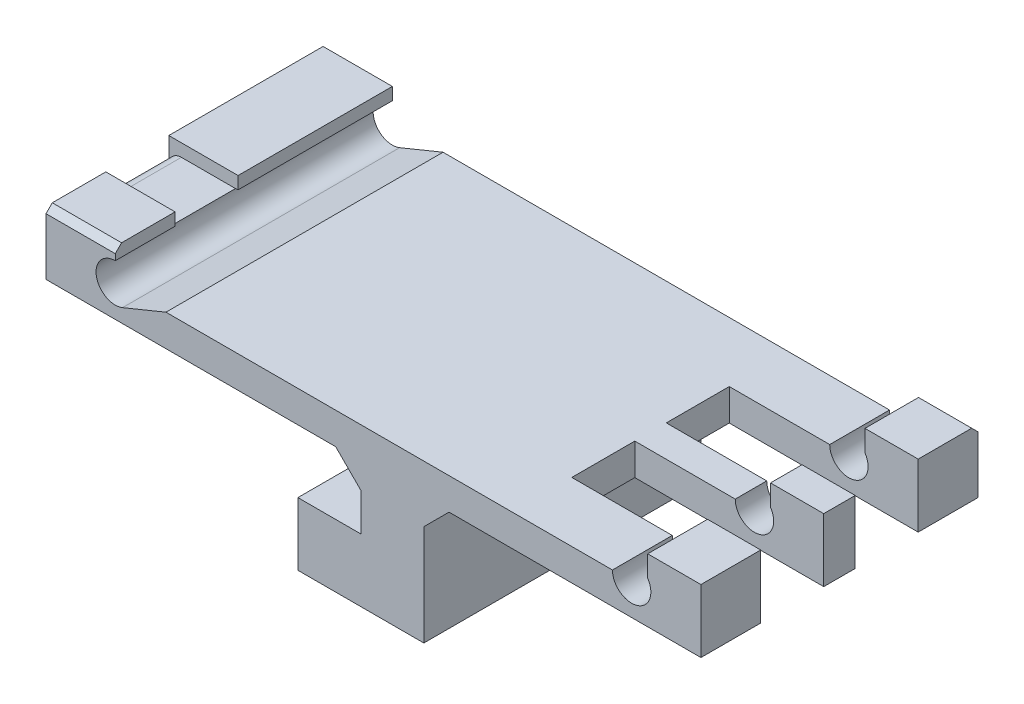
from build123d import *

# Parameters (mm, degrees)
EXTRUDE_1_DEPTH      = 10
EXTRUDE_1_DEPTH_BACK = 0.044975992
SKETCH_1_W           = 104
SKETCH_1_H           = 44
EXTRUDE_2_DEPTH      = 44
CUT_EXTRUDE_1_DEPTH  = 44
CHAMFER_4_SIZE       = 4
SKETCH_9_W           = 30
SKETCH_9_H           = 10
CUT_EXTRUDE_5_DEPTH  = 10.044975992
CUT_EXTRUDE_6_REACH  = 81.761
SKETCH_10_W          = 10
SKETCH_10_H          = 2
CUT_EXTRUDE_8_REACH  = 73.006
FILLET_1_R           = 2
CHAMFER_6_SIZE       = 1
CUT_EXTRUDE_9_DEPTH  = 44


with BuildPart() as part:
    # 草图1 → 凸台-拉伸1 (new, two sides: drawn at the far end of the back side and taken through both)
    with BuildSketch(Plane(origin=(0, 0, 0), x_dir=(1, 0, 0), z_dir=(0, 1, 0)).offset(-EXTRUDE_1_DEPTH_BACK)):
        Rectangle(SKETCH_1_W, SKETCH_1_H)
    extrude(amount=EXTRUDE_1_DEPTH + EXTRUDE_1_DEPTH_BACK)

    # 草图2 → 凸台-拉伸2 (add)
    with BuildSketch(Plane(origin=(0, 0, -22), x_dir=(-1, 0, 0), z_dir=(0, 0, -1))):
        Polygon((12, -20.044975992), (12, -10.044975992), (2, -10.044975992), (2, -0.044975992), (-8, -0.044975992), (-8, -10.525129165), (-8, -20.044975992), align=None)
    extrude(amount=-EXTRUDE_2_DEPTH)

    # 草图3 → 切除-拉伸1 (cut)
    with BuildSketch(Plane.XY.offset(22)):
        with BuildLine():
            Line((-44.05, 4.977512004), (-37.95, 4.977512004))
            ThreePointArc((-37.95, 4.977512004), (-37.950409974, 5.027518726), (-37.951639785, 5.077512004))
            Line((-37.951639785, 5.077512004), (-44.048360215, 5.077512004))
            ThreePointArc((-44.048360215, 5.077512004), (-44.049590026, 5.027518726), (-44.05, 4.977512004))
        make_face()
        with BuildLine():
            ThreePointArc((-37.951639785, 4.877512004), (-37.950409974, 4.927505282), (-37.95, 4.977512004))
            Line((-37.95, 4.977512004), (-44.05, 4.977512004))
            ThreePointArc((-44.05, 4.977512004), (-44.049590026, 4.927505282), (-44.048360215, 4.877512004))
            Line((-44.048360215, 4.877512004), (-37.951639785, 4.877512004))
        make_face()
        with BuildLine():
            ThreePointArc((-44.048360215, 4.877512004), (-41, 1.927512004), (-37.951639785, 4.877512004))
            Line((-37.951639785, 4.877512004), (-44.048360215, 4.877512004))
        make_face()
        with BuildLine():
            Line((-44.048360215, 5.077512004), (-37.951639785, 5.077512004))
            ThreePointArc((-37.951639785, 5.077512004), (-41, 8.027512004), (-44.048360215, 5.077512004))
        make_face()
        with BuildLine():
            Line((37.95, 4.977512004), (44.05, 4.977512004))
            ThreePointArc((44.05, 4.977512004), (44.049590026, 5.027518726), (44.048360215, 5.077512004))
            Line((44.048360215, 5.077512004), (37.951639785, 5.077512004))
            ThreePointArc((37.951639785, 5.077512004), (37.950409974, 5.027518726), (37.95, 4.977512004))
        make_face()
        with BuildLine():
            ThreePointArc((44.048360215, 4.877512004), (44.049590026, 4.927505282), (44.05, 4.977512004))
            Line((44.05, 4.977512004), (37.95, 4.977512004))
            ThreePointArc((37.95, 4.977512004), (37.950409974, 4.927505282), (37.951639785, 4.877512004))
            Line((37.951639785, 4.877512004), (44.048360215, 4.877512004))
        make_face()
        with BuildLine():
            ThreePointArc((37.951639785, 4.877512004), (41, 1.927512004), (44.048360215, 4.877512004))
            Line((44.048360215, 4.877512004), (37.951639785, 4.877512004))
        make_face()
        with BuildLine():
            Line((37.951639785, 5.077512004), (44.048360215, 5.077512004))
            ThreePointArc((44.048360215, 5.077512004), (41, 8.027512004), (37.951639785, 5.077512004))
        make_face()
    extrude(amount=-CUT_EXTRUDE_1_DEPTH, mode=Mode.SUBTRACT)

    # 倒角4
    chamfer_4_edges = [part.edges().sort_by_distance(p)[0] for p in [
        (-2, -0.044975992, 0),
        (8, -0.044975992, 0),
    ]]
    chamfer(chamfer_4_edges, length=CHAMFER_4_SIZE)

    # 草图9 → 切除-拉伸5 (cut)
    with BuildSketch(Plane.XZ.offset(0.044975992)):
        with Locations((37, 7.5)):
            Rectangle(SKETCH_9_W, SKETCH_9_H)
        with Locations((37, -7.5)):
            Rectangle(SKETCH_9_W, SKETCH_9_H)
    extrude(amount=-CUT_EXTRUDE_5_DEPTH, mode=Mode.SUBTRACT)

    # 切除-拉伸6: up to this face of the body (flat: up to its plane)
    cut_extrude_6_end = Plane(part.part.faces().sort_by_distance((-52, 4.977512004, 0))[0])
    # 草图10 → 切除-拉伸6 (cut, up to the picked face)
    with BuildSketch(Plane(origin=(22, 0, 0), x_dir=(0, 0, -1), z_dir=(1, 0, 0)), mode=Mode.PRIVATE) as cut_extrude_6_sk1:
        with Locations((-7.5, 9)):
            Rectangle(SKETCH_10_W, SKETCH_10_H)
    cut_extrude_6_tool1 = split(extrude(cut_extrude_6_sk1.sketch, amount=-CUT_EXTRUDE_6_REACH, mode=Mode.PRIVATE), bisect_by=cut_extrude_6_end, keep=Keep.BOTH, mode=Mode.PRIVATE)
    add(cut_extrude_6_tool1.solids().sort_by(Axis((22, 9, 7.5), (-1, 0, 0)))[0], mode=Mode.SUBTRACT)

    # 切除-拉伸8: up to this face of the body (flat: up to its plane)
    cut_extrude_8_end = Plane(part.part.faces().sort_by_distance((-0.039931558, 1.054666799, 22))[0])
    # 草图12 → 切除-拉伸8 (cut, up to the picked face)
    with BuildSketch(Plane(origin=(0, 0, -22), x_dir=(-1, 0, 0), z_dir=(0, 0, -1)), mode=Mode.PRIVATE) as cut_extrude_8_sk1:
        with BuildLine():
            Line((41, 10), (-43.55, 10))
            Line((-43.55, 10), (-43.55, 6.650832057))
            ThreePointArc((-43.55, 6.650832057), (-40.12678754, 7.899839843), (-37.95, 4.977512004))
            Line((-37.95, 4.977512004), (37.95, 4.977512004))
            ThreePointArc((37.95, 4.977512004), (38.843324317, 7.134187686), (41, 8.027512004))
            Line((41, 8.027512004), (41, 10))
        make_face()
    cut_extrude_8_tool1 = split(extrude(cut_extrude_8_sk1.sketch, amount=-CUT_EXTRUDE_8_REACH, mode=Mode.PRIVATE), bisect_by=cut_extrude_8_end, keep=Keep.BOTH, mode=Mode.PRIVATE)
    add(cut_extrude_8_tool1.solids().sort_by(Axis((0.637872, 7.552245, -22), (0, 0, 1)))[0], mode=Mode.SUBTRACT)

    # 圆角1
    fillet_1_edges = [part.edges().sort_by_distance(p)[0] for p in [
        (-52, 8, 7.5),
    ]]
    fillet(fillet_1_edges, radius=FILLET_1_R)

    # 倒角6
    chamfer_6_edges = [part.edges().sort_by_distance(p)[0] for p in [
        (47.775, 10, -22),
        (-46.5, 10, 22),
    ]]
    chamfer(chamfer_6_edges, length=CHAMFER_6_SIZE)

    # 草图13 → 切除-拉伸9 (cut)
    with BuildSketch(Plane.XY.offset(22)):
        with BuildLine():
            ThreePointArc((-37.95, 4.977512004), (-38.4675062, 3.277813455), (-39.844409938, 2.154904768))
            Line((-39.844409938, 2.154904768), (-32.95, 4.977512004))
            Line((-32.95, 4.977512004), (-37.95, 4.977512004))
        make_face()
    extrude(amount=-CUT_EXTRUDE_9_DEPTH, mode=Mode.SUBTRACT)


solid = part.part
